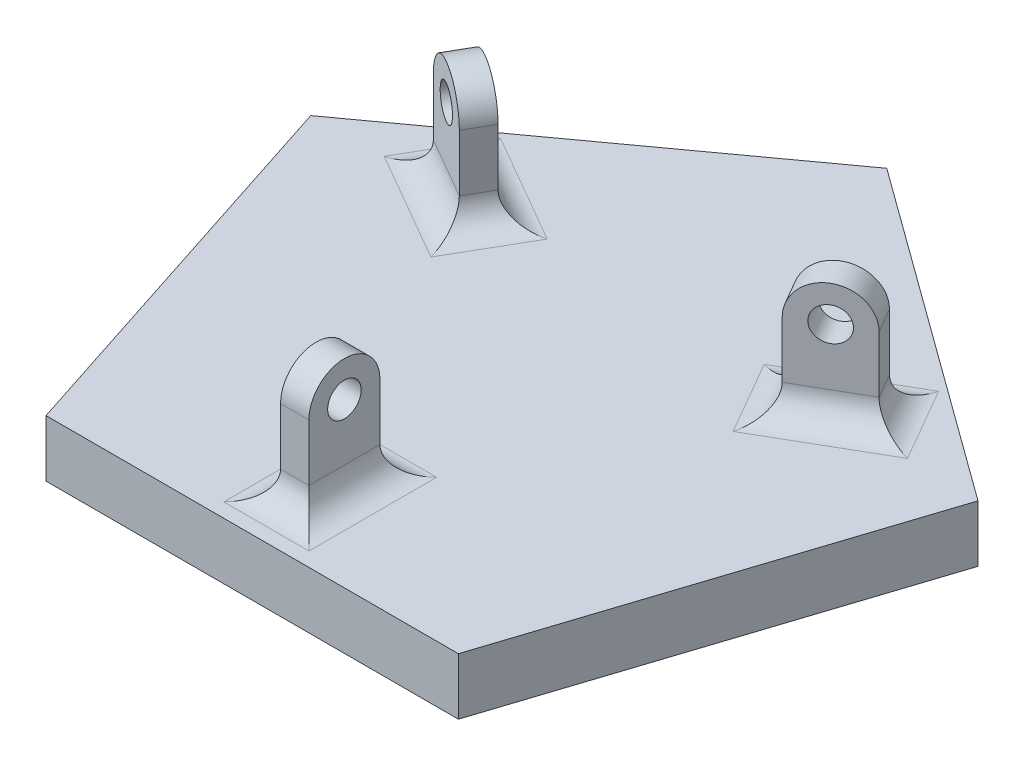
from build123d import *

# Parameters (mm, degrees)
SKETCH2_R                = 25.4
BOSS_EXTRUDE1_DEPTH      = 5.08
SKETCH3_R                = 1.5
BOSS_EXTRUDE2_DEPTH      = 1.27
FILLET1_R                = 2.54
CIRPATTERN1_COUNT        = 3
FILLET1_OF_CIRPATTERN1_R = 2.54


with BuildPart() as part:
    # Sketch2 → Boss-Extrude1 (new body)
    with BuildSketch(Plane(origin=(0, 0, 0), x_dir=(1, 0, 0), z_dir=(0, 1, 0))):
        Circle(SKETCH2_R)
        with BuildLine():
            ThreePointArc((-14.929745343, 20.549031704), (-2.12e-07, 25.4), (14.929745, 20.549031953))
            Line((14.929745, 20.549031953), (0, 31.396126628))
            Line((0, 31.396126628), (-14.929745343, 20.549031704))
        make_face()
        with BuildLine():
            ThreePointArc((-24.156835493, -7.84903172), (-24.156835512, 7.849031664), (-14.929745343, 20.549031704))
            Line((-14.929745343, 20.549031704), (-29.859490816, 9.701936686))
            Line((-29.859490816, 9.701936686), (-24.156835493, -7.84903172))
        make_face()
        with BuildLine():
            Line((-18.454180211, -25.4), (-1.11e-07, -25.4))
            ThreePointArc((-1.11e-07, -25.4), (-14.929745427, -20.549031644), (-24.156835493, -7.84903172))
            Line((-24.156835493, -7.84903172), (-18.454180211, -25.4))
        make_face()
        with BuildLine():
            Line((18.454180211, -25.4), (24.156835424, -7.849031932))
            ThreePointArc((24.156835424, -7.849031932), (14.929745246, -20.549031775), (-1.11e-07, -25.4))
            Line((-1.11e-07, -25.4), (18.454180211, -25.4))
        make_face()
        with BuildLine():
            Line((24.156835424, -7.849031932), (29.859490816, 9.701936686))
            Line((29.859490816, 9.701936686), (14.929745, 20.549031953))
            ThreePointArc((14.929745, 20.549031953), (22.6315656, 11.531358918), (25.4, 0))
            ThreePointArc((25.4, 0), (25.087283828, -3.973435555), (24.156835424, -7.849031932))
        make_face()
    extrude(amount=BOSS_EXTRUDE1_DEPTH)

    # Sketch3 → Boss-Extrude2 (add, symmetric)
    with BuildSketch(Plane(origin=(0, 0, 0), x_dir=(0, 0, -1), z_dir=(1, 0, 0))):
        with BuildLine():
            Line((-21.59, 12.7), (-21.59, 5.08))
            Line((-21.59, 5.08), (-15.24, 5.08))
            Line((-15.24, 5.08), (-15.24, 12.7))
            ThreePointArc((-15.24, 12.7), (-18.415, 15.875), (-21.59, 12.7))
        make_face()
        with Locations((-18.415, 12.7)):
            Circle(SKETCH3_R, mode=Mode.SUBTRACT)
    boss_extrude2 = extrude(amount=BOSS_EXTRUDE2_DEPTH, both=True)

    # Fillet1
    fillet1_edges = [part.edges().sort_by_distance(p)[0] for p in [
        (0, 5.08, 15.24),
        (-1.27, 5.08, 18.415),
        (0, 5.08, 21.59),
        (1.27, 5.08, 18.415),
    ]]
    fillet(fillet1_edges, radius=FILLET1_R)

    # CirPattern1: Boss-Extrude2 ×3 about axis
    cirpattern1_axis = Axis((0, 0, -0.710757359), (0, 1, 0))
    for i in range(1, CIRPATTERN1_COUNT):
        add(boss_extrude2.rotate(cirpattern1_axis, i * 360 / CIRPATTERN1_COUNT))

    # Fillet1 of CirPattern1
    fillet1_of_cirpattern1_edges = [part.edges().sort_by_distance(p)[0] for p in [
        (13.813761083, 5.08, -8.686136039),
        (17.19839174, 5.08, -9.173783776),
        (19.313022397, 5.08, -11.861136039),
        (15.92839174, 5.08, -11.373488302),
        (-13.813761083, 5.08, -8.686136039),
        (-15.92839174, 5.08, -11.373488302),
        (-19.313022397, 5.08, -11.861136039),
        (-17.19839174, 5.08, -9.173783776),
    ]]
    fillet(fillet1_of_cirpattern1_edges, radius=FILLET1_OF_CIRPATTERN1_R)


solid = part.part
